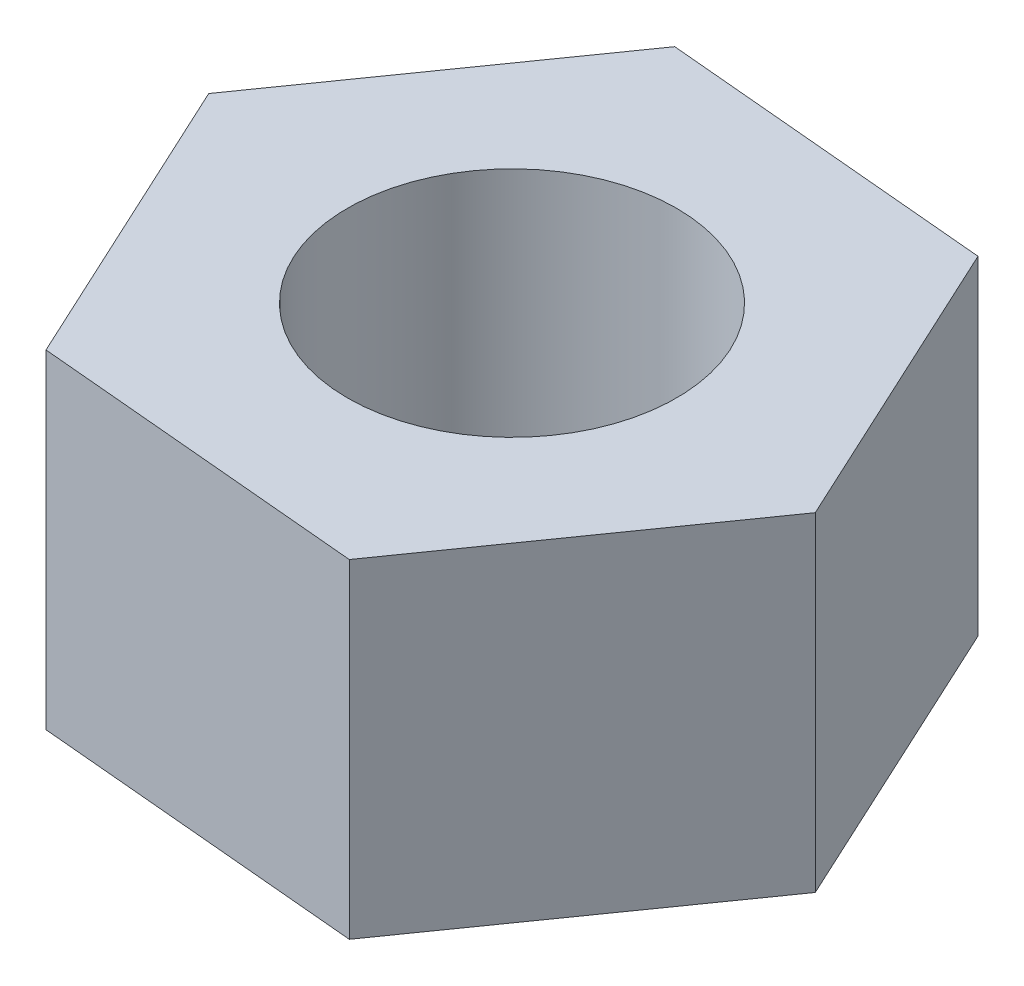
from build123d import *

# Parameters (mm, degrees)
SKETCH1_R           = 2
BOSS_EXTRUDE1_DEPTH = 4


with BuildPart() as part:
    # Sketch1 → Boss-Extrude1 (new body)
    with BuildSketch(Plane(origin=(0, 0, 0), x_dir=(1, 0, 0), z_dir=(0, 1, 0))):
        Polygon((1.710987568, -3.690052427), (4.051172927, -0.363267514), (2.340185359, 3.326784913), (-1.710987568, 3.690052427), (-4.051172927, 0.363267514), (-2.340185359, -3.326784913), align=None)
        with Locations(Location((0, 0, 0), (0, 0, 270))):
            Circle(SKETCH1_R, mode=Mode.SUBTRACT)
    extrude(amount=BOSS_EXTRUDE1_DEPTH)


solid = part.part
